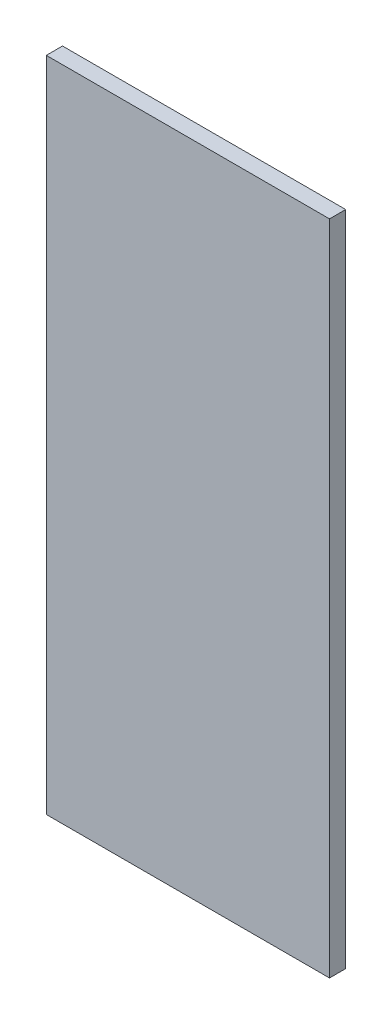
from build123d import *

# Parameters (mm, degrees)
SKETCH1_W           = 28
SKETCH1_H           = 65
BOSS_EXTRUDE1_DEPTH = 1.6


with BuildPart() as part:
    # Sketch1 → Boss-Extrude1 (new body)
    with BuildSketch(Plane.XY):
        Rectangle(SKETCH1_W, SKETCH1_H)
    extrude(amount=-BOSS_EXTRUDE1_DEPTH)


solid = part.part
